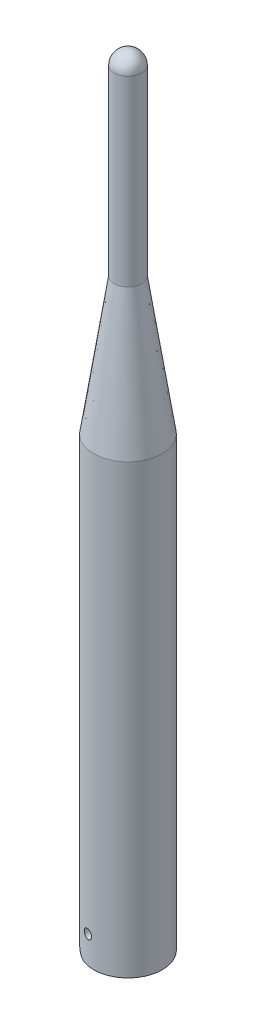
from build123d import *

# Parameters (mm, degrees)
SKETCH3_R               = 7.5
BOSS_EXTRUDE1_DEPTH     = 18
CUT_EXTRUDE1_START      = -12
CUT_EXTRUDE1_DEPTH      = 12
CHAMFER1_SIZE           = 2
CUT_EXTRUDE2_DEPTH      = 92.041199465
CUT_EXTRUDE2_DEPTH_BACK = 92.041199465
CUT_EXTRUDE3_DEPTH      = 92.041199585
CUT_EXTRUDE3_DEPTH_BACK = 92.041199585
SKETCH7_R               = 1


with BuildPart() as part:
    # Sketch2 → Revolve1 (revolve)
    with BuildSketch(Plane.XY, mode=Mode.PRIVATE) as revolve1_sk:
        with BuildLine():
            Line((7.5, -72), (7.5, 8))
            Line((7.5, 8), (3, 38))
            Line((3, 38), (3, 78))
            ThreePointArc((3, 78), (2.121320344, 80.121320344), (0, 81))
            Line((0, 81), (0, -72))
            Line((0, -72), (7.5, -72))
        make_face()
    revolve(revolve1_sk.sketch.rotate(Axis((0, 81, 0), (0, -1, 0)), 90), axis=Axis((0, 81, 0), (0, -1, 0)))

    # Sketch3 → Boss-Extrude1 (add)
    with BuildSketch(Plane.XZ.offset(72)):
        with Locations(Location((0, 0, 0), (0, 0, 90))):
            Circle(SKETCH3_R)
    extrude(amount=BOSS_EXTRUDE1_DEPTH)

    # Sketch4 → Cut-Extrude1 (cut)
    with BuildSketch(Plane.XZ.offset(90).offset(CUT_EXTRUDE1_START)):
        with BuildLine():
            Line((5.5, 4), (-6.34428877, 4))
            ThreePointArc((-6.34428877, 4), (-7.5, 0), (-6.34428877, -4))
            Line((-6.34428877, -4), (5.5, -4))
            Line((5.5, -4), (5.5, -0.585443259))
            Line((5.5, -0.585443259), (5.5, 0.585443259))
            Line((5.5, 0.585443259), (5.5, 4))
        make_face()
    extrude(amount=CUT_EXTRUDE1_DEPTH, mode=Mode.SUBTRACT)

    # Chamfer1
    chamfer1_edges = [part.edges().sort_by_distance(p)[0] for p in [
        (-7.5, -78, 0),
    ]]
    chamfer(chamfer1_edges, length=CHAMFER1_SIZE)

    # Sketch6 → Cut-Extrude2 (cut, two sides: drawn at the far end of the back side and taken through both)
    with BuildSketch(Plane.XY.offset(-4).offset(-CUT_EXTRUDE2_DEPTH_BACK)):
        with BuildLine():
            Line((-6.34428877, -86), (-6.34428877, -90))
            Line((-6.34428877, -90), (-2.34428877, -90))
            ThreePointArc((-2.34428877, -90), (-5.172715895, -88.828427125), (-6.34428877, -86))
        make_face()
    extrude(amount=CUT_EXTRUDE2_DEPTH + CUT_EXTRUDE2_DEPTH_BACK, mode=Mode.SUBTRACT)

    # Sketch7 → Cut-Extrude3 (cut, two sides: drawn at the far end of the back side and taken through both)
    with BuildSketch(Plane.XY.offset(-4).offset(-CUT_EXTRUDE3_DEPTH_BACK)):
        with Locations((-1.5, -84)):
            Circle(SKETCH7_R)
    extrude(amount=CUT_EXTRUDE3_DEPTH + CUT_EXTRUDE3_DEPTH_BACK, mode=Mode.SUBTRACT)


solid = part.part
